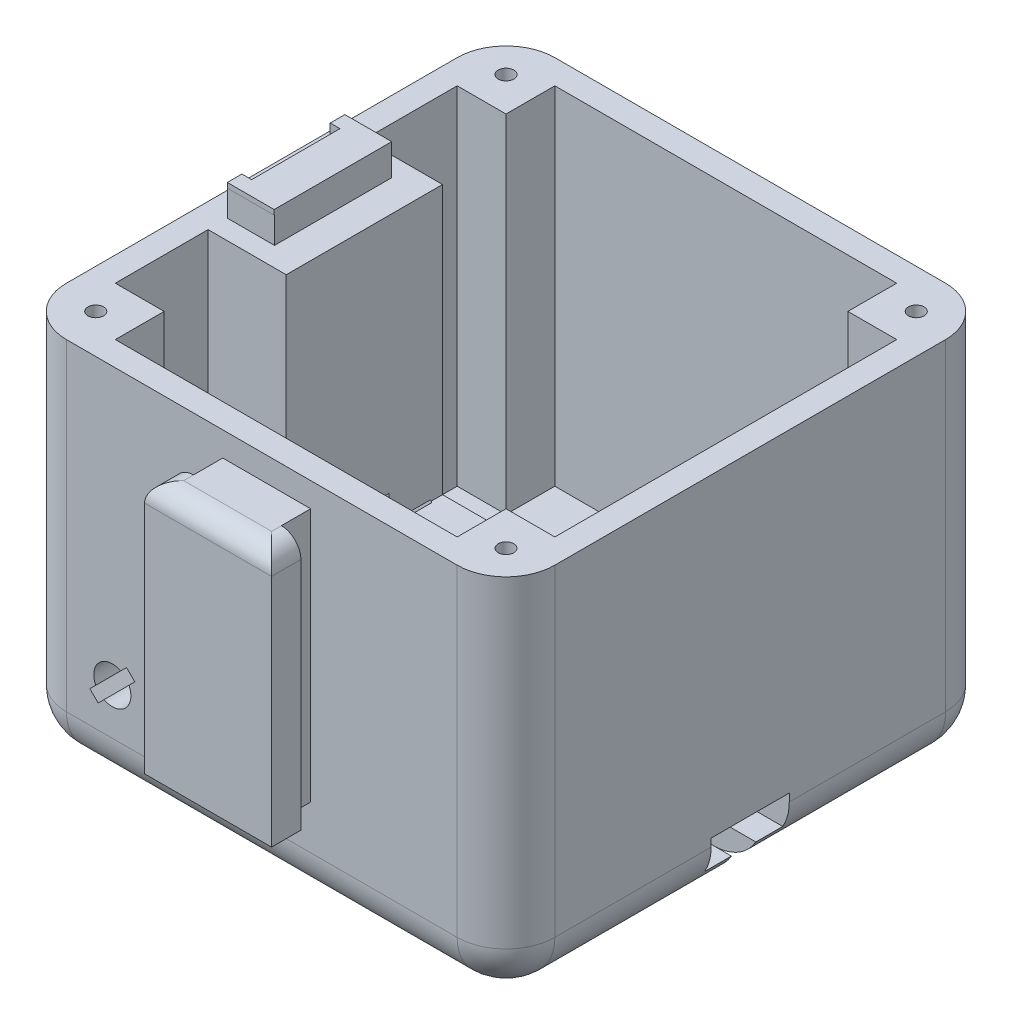
from build123d import *

# Parameters (mm, degrees)
SKETCH1_W                          = 50
SKETCH1_H                          = 50
BASE_SHELL_DEPTH                   = 38
SHELL1_T                           = -2.5
FILLET1_R                          = 5
SKETCH2_W                          = 13
SKETCH2_H                          = 26
LOCK_CONNECTOR_EXTRUDE_DEPTH       = 6
SKETCH3_W                          = 3
SKETCH3_H                          = 2
LOCK_CONNECTOR_CUT_DEPTH           = 54.350257731
LOCK_CONNECTOR_FILLET_R            = 2
SKETCH8_W                          = 45
SKETCH8_H                          = 16
BOTTOM_CONNECTOR_INSIDE_DEPTH      = 8
SKETCH10_W                         = 35.5
SKETCH10_H                         = 9.5
BOTTOM_FEMALE_BOTTOM_CUT_DEPTH     = 2.6
SKETCH7_W                          = 35.5
SKETCH7_H                          = 13.5
BOTTOM_FEMALE_TOP_CUT_DEPTH        = 3.2
ROUNDED_ENTRANCE_REACH             = 59.854
ROUNDED_ENTRANCE_DIRECTION_2_REACH = 59.854
SKETCH22_W                         = 8
SKETCH22_H                         = 3.3
HEADER_PIN_CUT_DEPTH               = 61.541308212
HEADER_PIN_HOLDER_REACH            = 57.045
SKETCH23_W                         = 14.435585072
SKETCH23_H                         = 2.5
SKETCH25_W                         = 2
SKETCH25_H                         = 3.1
WIRE_CUT_DEPTH                     = 52.21367005
SKETCH57_W                         = 1
SKETCH57_H                         = 2.45
PIN_STOPPER_DEPTH                  = 1
SKETCH15_W                         = 16
SKETCH15_H                         = 27.5
SIDE_CONNECTOR_INSIDE_DEPTH        = 8
SKETCH58_W                         = 3.3
SKETCH58_H                         = 8
SIDE_POGO_GAP_DEPTH                = 54.350257731
SKETCH60_W                         = 8
SKETCH60_H                         = 2.5
SIDE_POGO_SUPPORT_DEPTH            = 0.5
SKETCH14_R                         = 1.25
LOCK_BOTTOM_SUPPORT_DEPTH          = 4.5
SKETCH27_W                         = 5
SKETCH27_H                         = 5
SCREW_PILLAR_DEPTH                 = 35.5
MIRROR2_COPY_1_SKETCH_W            = 5
MIRROR2_COPY_1_SKETCH_H            = 5
MIRROR2_COPY_1_DEPTH               = 35.5
LOCK_SUPPORT_DEPTH                 = 17
LOCK_CUT_DEPTH                     = 19.5
SKETCH11_R                         = 3.75
SPRING_GAP_DEPTH                   = 20
FLANG_GAP_DEPTH                    = 19
FLANG_SCREW_CUT_DEPTH              = 2.5
FILLET2_R                          = 5
SKETCH59_W                         = 5.3
SKETCH59_H                         = 8
BOTTOM_POGO_SUPPORT_DEPTH          = 0.5
SKETCH62_W                         = 6.8
SKETCH62_H                         = 12
SKETCH62_W_2                       = 2.8
SKETCH62_H_2                       = 8
SIDE_POGO_HOLDER_DEPTH             = 2.7
SKETCH63_W                         = 6.8
SKETCH63_H                         = 12.036243668
SIDE_POGO_TOP_DEPTH                = 0.5
SIDE_POGO_HOLE_REACH               = 59.301
SKETCH64_W                         = 3
SKETCH64_H                         = 9.036243668
SKETCH65_W                         = 2
SKETCH65_H                         = 1.5
CUT_EXTRUDE8_DEPTH                 = 3.2


with BuildPart() as part:
    # Sketch1 → base shell (new body)
    with BuildSketch(Plane(origin=(0, 0, 0), x_dir=(1, 0, 0), z_dir=(0, 1, 0))):
        Rectangle(SKETCH1_W, SKETCH1_H)
    extrude(amount=BASE_SHELL_DEPTH)

    # Shell1
    shell1_openings = [part.faces().sort_by_distance(p)[0] for p in [
        (0, 38, 0),
    ]]
    offset(amount=SHELL1_T, openings=shell1_openings, kind=Kind.INTERSECTION)

    # Fillet1
    fillet1_edges = [part.edges().sort_by_distance(p)[0] for p in [
        (0, 0, -25),
        (25, 0, 0),
        (0, 0, 25),
        (-25, 0, 0),
        (-25, 19, -25),
        (25, 19, -25),
        (25, 19, 25),
        (-25, 19, 25),
    ]]
    fillet(fillet1_edges, radius=FILLET1_R)

    # Sketch2 → lock connector extrude (add)
    with BuildSketch(Plane.XY.offset(25)):
        with Locations((0.5, 22.5)):
            Rectangle(SKETCH2_W, SKETCH2_H)
    extrude(amount=LOCK_CONNECTOR_EXTRUDE_DEPTH)

    # Sketch3 → lock connector cut (cut, through all)
    with BuildSketch(Plane(origin=(0, 35.5, 0), x_dir=(0, 0, -1), z_dir=(0, 1, 0))):
        with Locations((-26.5, -6)):
            Rectangle(SKETCH3_W, SKETCH3_H)
        with Locations((-26.5, 5)):
            Rectangle(SKETCH3_W, SKETCH3_H)
    extrude(amount=-LOCK_CONNECTOR_CUT_DEPTH, mode=Mode.SUBTRACT)

    # lock connector fillet
    lock_connector_fillet_edges = [part.edges().sort_by_distance(p)[0] for p in [
        (7, 35.5, 29.5),
        (-6, 35.5, 29.5),
        (0.5, 35.5, 31),
    ]]
    fillet(lock_connector_fillet_edges, radius=LOCK_CONNECTOR_FILLET_R)

    # Sketch8 → bottom connector inside (add)
    with BuildSketch(Plane(origin=(0, 2.5, 0), x_dir=(1, 0, 0), z_dir=(0, 1, 0))):
        Rectangle(SKETCH8_W, SKETCH8_H)
    extrude(amount=BOTTOM_CONNECTOR_INSIDE_DEPTH)

    # Sketch10 → bottom female bottom cut (cut)
    with BuildSketch(Plane.XZ):
        with Locations((-7.25, 0)):
            Rectangle(SKETCH10_W, SKETCH10_H)
    bottom_female_bottom_cut = extrude(amount=-BOTTOM_FEMALE_BOTTOM_CUT_DEPTH, mode=Mode.SUBTRACT)

    # Sketch7 → bottom female top cut (cut)
    with BuildSketch(Plane(origin=(0, 2.6, 0), x_dir=(-1, 0, 0), z_dir=(0, -1, 0))):
        with Locations((7.25, 0)):
            Rectangle(SKETCH7_W, SKETCH7_H)
    bottom_female_top_cut = extrude(amount=-BOTTOM_FEMALE_TOP_CUT_DEPTH, mode=Mode.SUBTRACT)

    # rounded entrance: up to this face of the body (flat: up to its plane)
    rounded_entrance_end = Plane(part.part.faces().sort_by_distance((-7.175733888, 4.204259527, -6.75))[0])
    # Sketch26 → rounded entrance (cut, up to the picked face)
    with BuildSketch(Plane.XY.offset(-4.75), mode=Mode.PRIVATE) as rounded_entrance_sk1:
        with BuildLine():
            Line((-16, 2.6), (-24.38634244, 2.6))
            ThreePointArc((-24.38634244, 2.6), (-22.549509757, 0.698837366), (-20, 0))
            Line((-20, 0), (-18.5, 0))
            ThreePointArc((-18.5, 0), (-17.773607635, 1.80346888), (-16, 2.6))
        make_face()
    rounded_entrance_tool1 = split(extrude(rounded_entrance_sk1.sketch, amount=-ROUNDED_ENTRANCE_REACH, mode=Mode.PRIVATE), bisect_by=rounded_entrance_end, keep=Keep.BOTH, mode=Mode.PRIVATE)
    rounded_entrance = rounded_entrance_tool1.solids().sort_by(Axis((-20.596969, 1.517539, -4.75), (0, 0, -1)))[0]
    add(rounded_entrance, mode=Mode.SUBTRACT)

    # rounded entrance direction 2: up to this face of the body (flat: up to its plane)
    rounded_entrance_direction_2_end = Plane(part.part.faces().sort_by_distance((-7.175733888, 4.204259527, 6.75))[0])
    # Sketch26 → rounded entrance direction 2 (cut, up to the picked face)
    with BuildSketch(Plane.XY.offset(-4.75), mode=Mode.PRIVATE) as rounded_entrance_direction_2_sk1:
        with BuildLine():
            Line((-16, 2.6), (-24.38634244, 2.6))
            ThreePointArc((-24.38634244, 2.6), (-22.549509757, 0.698837366), (-20, 0))
            Line((-20, 0), (-18.5, 0))
            ThreePointArc((-18.5, 0), (-17.773607635, 1.80346888), (-16, 2.6))
        make_face()
    rounded_entrance_direction_2_tool1 = split(extrude(rounded_entrance_direction_2_sk1.sketch, amount=ROUNDED_ENTRANCE_DIRECTION_2_REACH, mode=Mode.PRIVATE), bisect_by=rounded_entrance_direction_2_end, keep=Keep.BOTH, mode=Mode.PRIVATE)
    rounded_entrance_direction_2 = rounded_entrance_direction_2_tool1.solids().sort_by(Axis((-20.596969, 1.517539, -4.75), (0, 0, 1)))[0]
    add(rounded_entrance_direction_2, mode=Mode.SUBTRACT)

    # Sketch22 → header pin cut (cut, through all)
    with BuildSketch(Plane.ZY.offset(-10.5)):
        with Locations((0, 4.15)):
            Rectangle(SKETCH22_W, SKETCH22_H)
    extrude(amount=-HEADER_PIN_CUT_DEPTH, mode=Mode.SUBTRACT)

    # Sketch23 → header pin holder (cut, up to next)
    with BuildSketch(Plane.XZ, mode=Mode.PRIVATE) as header_pin_holder_sk1:
        with Locations((17.717792536, 0)):
            Rectangle(SKETCH23_W, SKETCH23_H)
    header_pin_holder_tool1 = extrude(header_pin_holder_sk1.sketch, amount=-HEADER_PIN_HOLDER_REACH, mode=Mode.PRIVATE) & part.part
    add(header_pin_holder_tool1.solids().sort_by_distance((17.717793, 0, 0))[0], mode=Mode.SUBTRACT)

    # Sketch25 → wire cut (cut, through all)
    with BuildSketch(Plane(origin=(0, 5.8, 0), x_dir=(-1, 0, 0), z_dir=(0, -1, 0))):
        with Locations((-16.5, 0)):
            Rectangle(SKETCH25_W, SKETCH25_H)
    extrude(amount=-WIRE_CUT_DEPTH, mode=Mode.SUBTRACT)

    # Sketch57 → pin stopper (add)
    with BuildSketch(Plane.XZ.offset(-5.8)):
        with Locations((16.3, 2.775)):
            Rectangle(SKETCH57_W, SKETCH57_H)
        with Locations((16.3, -2.775)):
            Rectangle(SKETCH57_W, SKETCH57_H)
    extrude(amount=PIN_STOPPER_DEPTH)

    # Sketch15 → side connector inside (add)
    with BuildSketch(Plane(origin=(-22.5, 0, 0), x_dir=(0, 0, -1), z_dir=(1, 0, 0))):
        with Locations((0, 24.25)):
            Rectangle(SKETCH15_W, SKETCH15_H)
    extrude(amount=SIDE_CONNECTOR_INSIDE_DEPTH)

    # side connector mirror: bottom female bottom cut, bottom female top cut, rounded entrance, rounded entrance direction 2 across plane
    add(bottom_female_bottom_cut.mirror(Plane(origin=(-12.5, 12.5, 0), x_dir=(0, 0, 1), z_dir=(0.7071067811865488, -0.7071067811865464, 0))), mode=Mode.SUBTRACT)
    add(bottom_female_top_cut.mirror(Plane(origin=(-12.5, 12.5, 0), x_dir=(0, 0, 1), z_dir=(0.7071067811865488, -0.7071067811865464, 0))), mode=Mode.SUBTRACT)
    add(rounded_entrance.mirror(Plane(origin=(-12.5, 12.5, 0), x_dir=(0, 0, 1), z_dir=(0.7071067811865488, -0.7071067811865464, 0))), mode=Mode.SUBTRACT)
    add(rounded_entrance_direction_2.mirror(Plane(origin=(-12.5, 12.5, 0), x_dir=(0, 0, 1), z_dir=(0.7071067811865488, -0.7071067811865464, 0))), mode=Mode.SUBTRACT)

    # Sketch58 → side pogo gap (cut, through all)
    with BuildSketch(Plane.XZ.offset(-35.5)):
        with Locations((-20.85, 0)):
            Rectangle(SKETCH58_W, SKETCH58_H)
    extrude(amount=-SIDE_POGO_GAP_DEPTH, mode=Mode.SUBTRACT)

    # Sketch60 → side pogo support (add)
    with BuildSketch(Plane.ZY.offset(19.2)):
        with Locations((0, 36.75)):
            Rectangle(SKETCH60_W, SKETCH60_H)
    extrude(amount=SIDE_POGO_SUPPORT_DEPTH)

    # Sketch14 → Lock bottom support (add)
    with BuildSketch(Plane.XY.offset(-6.75)):
        with Locations((-15.3, 9.7)):
            Circle(SKETCH14_R)
    extrude(amount=LOCK_BOTTOM_SUPPORT_DEPTH)

    # Sketch27 → screw pillar (add)
    with BuildSketch(Plane(origin=(0, 2.5, 0), x_dir=(1, 0, 0), z_dir=(0, 1, 0))):
        with Locations((20, 20)):
            Rectangle(SKETCH27_W, SKETCH27_H)
    screw_pillar = extrude(amount=SCREW_PILLAR_DEPTH)

    # Sketch29 → M2 Tapped Hole1 (revolve, cut)
    with BuildSketch(Plane(origin=(21, 38, -21), x_dir=(0, 0, 1), z_dir=(1, 0, 0))):
        Polygon((0, 0), (0, 5.480688495), (0.8, 5), (0.8, 0), align=None)
    m2_tapped_hole1 = revolve(axis=Axis((21, 44.35, -21), (0, -1, 0)), mode=Mode.SUBTRACT)

    # Mirror1: screw pillar, M2 Tapped Hole1 across plane
    add(screw_pillar.mirror(Plane(origin=(0, 0, 0), x_dir=(0, 0, 1), z_dir=(1, 0, 0))))
    add(m2_tapped_hole1.mirror(Plane(origin=(0, 0, 0), x_dir=(0, 0, 1), z_dir=(1, 0, 0))), mode=Mode.SUBTRACT)

    # Mirror2: screw pillar, M2 Tapped Hole1 across plane
    add(screw_pillar.mirror(Plane.XY))
    add(m2_tapped_hole1.mirror(Plane.XY), mode=Mode.SUBTRACT)

    # Mirror2 copy 1 sketch → Mirror2 copy 1 (add)
    with BuildSketch(Plane(origin=(0, 2.5, 0), x_dir=(-1, 0, 0), z_dir=(0, 1, 0))):
        with Locations((20, 20)):
            Rectangle(MIRROR2_COPY_1_SKETCH_W, MIRROR2_COPY_1_SKETCH_H)
    extrude(amount=MIRROR2_COPY_1_DEPTH)

    # Mirror2 copy 2 sketch → Mirror2 copy 2 (revolve, cut)
    with BuildSketch(Plane(origin=(-21, 38, 21), x_dir=(0, 0, -1), z_dir=(-1, 0, 0))):
        Polygon((0, 0), (0, 5.480688495), (0.8, 5), (0.8, 0), align=None)
    revolve(axis=Axis((-21, 44.35, 21), (0, -1, 0)), mode=Mode.SUBTRACT)

    # Sketch41 → lock support (add)
    with BuildSketch(Plane(origin=(0, 2.5, 0), x_dir=(1, 0, 0), z_dir=(0, 1, 0))):
        Polygon((-22.5, -22.5), (-8.5, -22.5), (-8.5, -8), (-22.5, -8), (-22.5, -17), align=None)
    extrude(amount=LOCK_SUPPORT_DEPTH)

    # Sketch6 → lock cut (cut)
    with BuildSketch(Plane.XY.offset(25)):
        with BuildLine():
            ThreePointArc((-16.15049081, 8.000981053), (-16.643502884, 8.356497116), (-16.999018947, 8.84950919))
            Line((-16.999018947, 8.84950919), (-17.600059711, 8.248468426))
            Line((-17.600059711, 8.248468426), (-16.751531574, 7.399940289))
            Line((-16.751531574, 7.399940289), (-16.15049081, 8.000981053))
        make_face()
        with BuildLine():
            ThreePointArc((-14.44950919, 11.399018947), (-13.956497116, 11.043502884), (-13.600981053, 10.55049081))
            Line((-13.600981053, 10.55049081), (-12.999940289, 11.151531574))
            Line((-12.999940289, 11.151531574), (-13.848468426, 12.000059711))
            Line((-13.848468426, 12.000059711), (-14.44950919, 11.399018947))
        make_face()
        with BuildLine():
            ThreePointArc((-13.4, 9.7), (-13.4509278, 10.136957664), (-13.600981053, 10.55049081))
            ThreePointArc((-13.600981053, 10.55049081), (-13.956497116, 11.043502884), (-14.44950919, 11.399018947))
            ThreePointArc((-14.44950919, 11.399018947), (-16.643502884, 11.043502884), (-16.999018947, 8.84950919))
            ThreePointArc((-16.999018947, 8.84950919), (-16.643502884, 8.356497116), (-16.15049081, 8.000981053))
            ThreePointArc((-16.15049081, 8.000981053), (-14.301484236, 8.083532781), (-13.4, 9.7))
        make_face()
    extrude(amount=-LOCK_CUT_DEPTH, mode=Mode.SUBTRACT)

    # Sketch11 → Spring gap (cut)
    with BuildSketch(Plane.XY.offset(-2.5)):
        with Locations(Location((-15.3, 9.7, 0), (0, 0, 77.682234017))):
            Circle(SKETCH11_R)
    extrude(amount=SPRING_GAP_DEPTH, mode=Mode.SUBTRACT)

    # Sketch12 → Flang gap (cut)
    with BuildSketch(Plane.XY.offset(-2.5)):
        with BuildLine():
            Line((-15.3, 9.7), (-13.274593025, 3.523615411))
            ThreePointArc((-13.274593025, 3.523615411), (-19.63620247, 4.857753812), (-21.661609445, 11.034138401))
            Line((-21.661609445, 11.034138401), (-15.3, 9.7))
        make_face()
    extrude(amount=FLANG_GAP_DEPTH, mode=Mode.SUBTRACT)

    # Sketch52 → flang screw cut (cut)
    with BuildSketch(Plane(origin=(0, 0, 6.75), x_dir=(-1, 0, 0), z_dir=(0, 0, -1))):
        with BuildLine():
            Line((21.568994271, 7.982527778), (25, 5))
            add(Edge.make_bspline(
                [(25, 5), (26.808053779, 2.347485232), (22.598490609, -3.321737418), (20, 0)],
                knots=[0, 0, 0, 0, 1, 1, 1, 1], degree=3))
            Line((20, 0), (17.017472222, 3.431005729))
            Line((17.017472222, 3.431005729), (21.568994271, 7.982527778))
        make_face()
    extrude(amount=-FLANG_SCREW_CUT_DEPTH, mode=Mode.SUBTRACT)

    # Fillet2
    fillet2_edges = [part.edges().sort_by_distance(p)[0] for p in [
        (-19.2, 5.8, -4.625),
    ]]
    fillet(fillet2_edges, radius=FILLET2_R)

    # Sketch59 → bottom pogo support (add)
    with BuildSketch(Plane.XZ.offset(-5.8)):
        with Locations((13.15, 0)):
            Rectangle(SKETCH59_W, SKETCH59_H)
    extrude(amount=BOTTOM_POGO_SUPPORT_DEPTH)

    # Sketch62 → side pogo holder (add)
    with BuildSketch(Plane(origin=(0, 38, 0), x_dir=(1, 0, 0), z_dir=(0, 1, 0))):
        with Locations((-21.1, 0)):
            Rectangle(SKETCH62_W, SKETCH62_H)
        with Locations((-21.1, 0)):
            Rectangle(SKETCH62_W_2, SKETCH62_H_2, mode=Mode.SUBTRACT)
    extrude(amount=SIDE_POGO_HOLDER_DEPTH)

    # Sketch63 → side pogo top (add)
    with BuildSketch(Plane(origin=(0, 40.7, 0), x_dir=(1, 0, 0), z_dir=(0, 1, 0))):
        with Locations((-21.1, -0.018121834)):
            Rectangle(SKETCH63_W, SKETCH63_H)
    extrude(amount=SIDE_POGO_TOP_DEPTH)

    # side pogo hole: up to this face of the body (flat: up to its plane)
    side_pogo_hole_end = Plane(part.part.faces().sort_by_distance((0, 38, -24.292893219))[0])
    # Sketch64 → side pogo hole (cut, up to the picked face)
    with BuildSketch(Plane(origin=(0, 41.2, 0), x_dir=(1, 0, 0), z_dir=(0, 1, 0)), mode=Mode.PRIVATE) as side_pogo_hole_sk1:
        with Locations((-23, -0.018121834)):
            Rectangle(SKETCH64_W, SKETCH64_H)
    side_pogo_hole_tool1 = split(extrude(side_pogo_hole_sk1.sketch, amount=-SIDE_POGO_HOLE_REACH, mode=Mode.PRIVATE), bisect_by=side_pogo_hole_end, keep=Keep.BOTH, mode=Mode.PRIVATE)
    add(side_pogo_hole_tool1.solids().sort_by(Axis((-23, 41.2, 0.018122), (0, -1, 0)))[0], mode=Mode.SUBTRACT)

    # Sketch65 → Cut-Extrude8 (cut)
    with BuildSketch(Plane(origin=(0, 41.2, 0), x_dir=(1, 0, 0), z_dir=(0, 1, 0))):
        with Locations((-23.5, -5.286243668)):
            Rectangle(SKETCH65_W, SKETCH65_H)
        with Locations((-23.5, 5.25)):
            Rectangle(SKETCH65_W, SKETCH65_H)
    extrude(amount=-CUT_EXTRUDE8_DEPTH, mode=Mode.SUBTRACT)


solid = part.part
